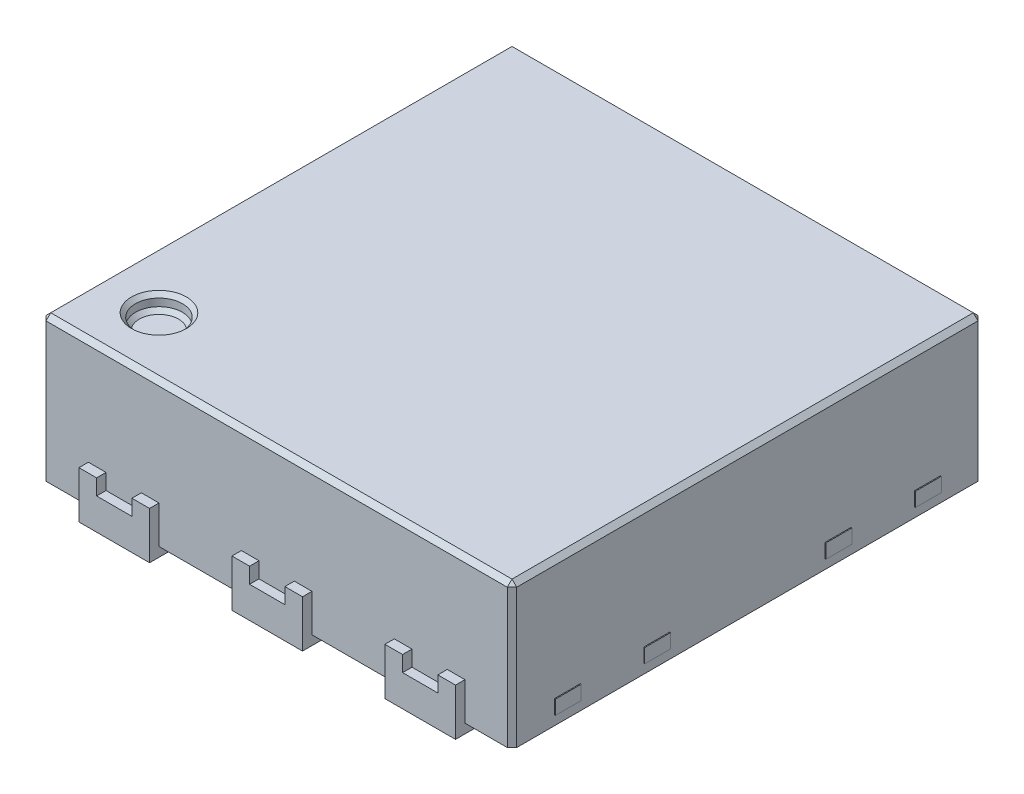
from build123d import *

# Parameters (mm, degrees)
BOSS_EXTRUDE1_DEPTH        = 0.2
SKETCH1_W                  = 0.67
SKETCH1_H                  = 1
BOSS_EXTRUDE1_2_DEPTH      = 0.2
SKETCH1_W_2                = 0.3
SKETCH1_H_2                = 0.29
BOSS_EXTRUDE1_3_DEPTH      = 0.2
BOSS_EXTRUDE1_4_DEPTH      = 0.2
BOSS_EXTRUDE1_5_DEPTH      = 0.2
BOSS_EXTRUDE1_6_DEPTH      = 0.2
BOSS_EXTRUDE1_7_DEPTH      = 0.2
BOSS_EXTRUDE1_8_DEPTH      = 0.2
SKETCH2_W                  = 0.15
SKETCH2_H                  = 0.133333334
CUT_EXTRUDE1_DEPTH         = 3.246558479
BOSS_EXTRUDE2_START        = 0.04
SKETCH3_W                  = 2
SKETCH3_H                  = 2
BOSS_EXTRUDE2_DEPTH        = 0.61
BOSS_EXTRUDE3_DEPTH        = 0.004
BOSS_EXTRUDE3_DEPTH_BACK   = 2.004
SKETCH4_W                  = 0.11
SKETCH4_H                  = 0.06
BOSS_EXTRUDE3_2_DEPTH      = 0.004
BOSS_EXTRUDE3_2_DEPTH_BACK = 2.004
BOSS_EXTRUDE3_3_DEPTH      = 0.004
BOSS_EXTRUDE3_3_DEPTH_BACK = 2.004
BOSS_EXTRUDE3_4_DEPTH      = 0.004
BOSS_EXTRUDE3_4_DEPTH_BACK = 2.004
SKETCH5_R                  = 0.1
CUT_EXTRUDE2_DEPTH         = 0.065
CHAMFER1_SIZE              = 0.016666667
CHAMFER2_SIZE              = 0.02


with BuildPart() as part:
    # Sketch1 → Boss-Extrude1 (new body)
    with BuildSketch(Plane(origin=(0, 0, 0), x_dir=(1, 0, 0), z_dir=(0, 1, 0))):
        Polygon((-0.825, 0.5), (-0.155, 0.5), (-0.155, -0.5), (-0.6575, -0.5), (-0.825, -0.3325), align=None)
    extrude(amount=BOSS_EXTRUDE1_DEPTH)


with BuildPart() as body_2:
    # Sketch1 → Boss-Extrude1 2 (new body)
    with BuildSketch(Plane(origin=(0, 0, 0), x_dir=(1, 0, 0), z_dir=(0, 1, 0))):
        with Locations((0.49, 0)):
            Rectangle(SKETCH1_W, SKETCH1_H)
    extrude(amount=BOSS_EXTRUDE1_2_DEPTH)


with BuildPart() as body_3:
    # Sketch1 → Boss-Extrude1 3 (new body)
    with BuildSketch(Plane(origin=(0, 0, 0), x_dir=(1, 0, 0), z_dir=(0, 1, 0))):
        with Locations((0, 0.895)):
            Rectangle(SKETCH1_W_2, SKETCH1_H_2)
    extrude(amount=BOSS_EXTRUDE1_3_DEPTH)


with BuildPart() as body_4:
    # Sketch1 → Boss-Extrude1 4 (new body)
    with BuildSketch(Plane(origin=(0, 0, 0), x_dir=(1, 0, 0), z_dir=(0, 1, 0))):
        with Locations((-0.65, 0.895)):
            Rectangle(SKETCH1_W_2, SKETCH1_H_2)
    extrude(amount=BOSS_EXTRUDE1_4_DEPTH)


with BuildPart() as body_5:
    # Sketch1 → Boss-Extrude1 5 (new body)
    with BuildSketch(Plane(origin=(0, 0, 0), x_dir=(1, 0, 0), z_dir=(0, 1, 0))):
        with Locations((0.65, 0.895)):
            Rectangle(SKETCH1_W_2, SKETCH1_H_2)
    extrude(amount=BOSS_EXTRUDE1_5_DEPTH)


with BuildPart() as body_6:
    # Sketch1 → Boss-Extrude1 6 (new body)
    with BuildSketch(Plane(origin=(0, 0, 0), x_dir=(1, 0, 0), z_dir=(0, 1, 0))):
        with Locations((0, -0.895)):
            Rectangle(SKETCH1_W_2, SKETCH1_H_2)
    extrude(amount=BOSS_EXTRUDE1_6_DEPTH)


with BuildPart() as body_7:
    # Sketch1 → Boss-Extrude1 7 (new body)
    with BuildSketch(Plane(origin=(0, 0, 0), x_dir=(1, 0, 0), z_dir=(0, 1, 0))):
        with Locations((0.65, -0.895)):
            Rectangle(SKETCH1_W_2, SKETCH1_H_2)
    extrude(amount=BOSS_EXTRUDE1_7_DEPTH)


with BuildPart() as body_8:
    # Sketch1 → Boss-Extrude1 8 (new body)
    with BuildSketch(Plane(origin=(0, 0, 0), x_dir=(1, 0, 0), z_dir=(0, 1, 0))):
        with Locations((-0.65, -0.895)):
            Rectangle(SKETCH1_W_2, SKETCH1_H_2)
    extrude(amount=BOSS_EXTRUDE1_8_DEPTH)


with BuildPart() as cut_extrude1_tool:
    # Sketch2 → Cut-Extrude1 (new, through all)
    with BuildSketch(Plane.XY.offset(1.04)):
        with Locations((-0.65, 0.2)):
            Rectangle(SKETCH2_W, SKETCH2_H)
        with Locations((0, 0.2)):
            Rectangle(SKETCH2_W, SKETCH2_H)
        with Locations((0.65, 0.2)):
            Rectangle(SKETCH2_W, SKETCH2_H)
    extrude(amount=-CUT_EXTRUDE1_DEPTH)


with BuildPart() as part_1:
    add(part.part)

    # Cut-Extrude1: cut by cut_extrude1_tool
    add(cut_extrude1_tool.part, mode=Mode.SUBTRACT)


with BuildPart() as body_2_1:
    add(body_2.part)

    # Cut-Extrude1: cut by cut_extrude1_tool
    add(cut_extrude1_tool.part, mode=Mode.SUBTRACT)


with BuildPart() as body_3_1:
    add(body_3.part)

    # Cut-Extrude1: cut by cut_extrude1_tool
    add(cut_extrude1_tool.part, mode=Mode.SUBTRACT)


with BuildPart() as body_4_1:
    add(body_4.part)

    # Cut-Extrude1: cut by cut_extrude1_tool
    add(cut_extrude1_tool.part, mode=Mode.SUBTRACT)


with BuildPart() as body_5_1:
    add(body_5.part)

    # Cut-Extrude1: cut by cut_extrude1_tool
    add(cut_extrude1_tool.part, mode=Mode.SUBTRACT)


with BuildPart() as body_6_1:
    add(body_6.part)

    # Cut-Extrude1: cut by cut_extrude1_tool
    add(cut_extrude1_tool.part, mode=Mode.SUBTRACT)


with BuildPart() as body_7_1:
    add(body_7.part)

    # Cut-Extrude1: cut by cut_extrude1_tool
    add(cut_extrude1_tool.part, mode=Mode.SUBTRACT)


with BuildPart() as body_8_1:
    add(body_8.part)

    # Cut-Extrude1: cut by cut_extrude1_tool
    add(cut_extrude1_tool.part, mode=Mode.SUBTRACT)


with BuildPart() as body_9:
    # Sketch3 → Boss-Extrude2 (new body)
    with BuildSketch(Plane(origin=(0, 0, 0), x_dir=(1, 0, 0), z_dir=(0, 1, 0)).offset(BOSS_EXTRUDE2_START)):
        Rectangle(SKETCH3_W, SKETCH3_H)
    extrude(amount=BOSS_EXTRUDE2_DEPTH)

    # Sketch5 → Cut-Extrude2 (cut)
    with BuildSketch(Plane(origin=(0, 0.65, 0), x_dir=(1, 0, 0), z_dir=(0, 1, 0))):
        with Locations(Location((-0.75, -0.75, 0), (0, 0, 270))):
            Circle(SKETCH5_R)
    extrude(amount=-CUT_EXTRUDE2_DEPTH, mode=Mode.SUBTRACT)

    # Chamfer1
    chamfer1_edges = [body_9.edges().sort_by_distance(p)[0] for p in [
        (-0.75, 0.585, 0.65),
        (-0.75, 0.65, 0.65),
    ]]
    chamfer(chamfer1_edges, length=CHAMFER1_SIZE)

    # Chamfer2
    chamfer2_edges = [body_9.edges().sort_by_distance(p)[0] for p in [
        (-1, 0.65, 0),
        (0, 0.65, 1),
        (1, 0.65, 0),
        (0, 0.65, -1),
        (1, 0.345, 1),
        (-1, 0.345, 1),
        (-1, 0.345, -1),
        (1, 0.345, -1),
    ]]
    chamfer(chamfer2_edges, length=CHAMFER2_SIZE)


with BuildPart() as body_10:
    # Sketch4 → Boss-Extrude3 (new, two sides: drawn at the far end of the back side and taken through both)
    with BuildSketch(Plane(origin=(1, 0, 0), x_dir=(0, 0, -1), z_dir=(1, 0, 0)).offset(-BOSS_EXTRUDE3_DEPTH_BACK)):
        with Locations((-0.765, 0.11)):
            Rectangle(SKETCH4_W, SKETCH4_H)
    extrude(amount=BOSS_EXTRUDE3_DEPTH + BOSS_EXTRUDE3_DEPTH_BACK)


with BuildPart() as body_11:
    # Sketch4 → Boss-Extrude3 2 (new, two sides: drawn at the far end of the back side and taken through both)
    with BuildSketch(Plane(origin=(1, 0, 0), x_dir=(0, 0, -1), z_dir=(1, 0, 0)).offset(-BOSS_EXTRUDE3_2_DEPTH_BACK)):
        with Locations((-0.385, 0.11)):
            Rectangle(SKETCH4_W, SKETCH4_H)
    extrude(amount=BOSS_EXTRUDE3_2_DEPTH + BOSS_EXTRUDE3_2_DEPTH_BACK)


with BuildPart() as body_12:
    # Sketch4 → Boss-Extrude3 3 (new, two sides: drawn at the far end of the back side and taken through both)
    with BuildSketch(Plane(origin=(1, 0, 0), x_dir=(0, 0, -1), z_dir=(1, 0, 0)).offset(-BOSS_EXTRUDE3_3_DEPTH_BACK)):
        with Locations((0.385, 0.11)):
            Rectangle(SKETCH4_W, SKETCH4_H)
    extrude(amount=BOSS_EXTRUDE3_3_DEPTH + BOSS_EXTRUDE3_3_DEPTH_BACK)


with BuildPart() as body_13:
    # Sketch4 → Boss-Extrude3 4 (new, two sides: drawn at the far end of the back side and taken through both)
    with BuildSketch(Plane(origin=(1, 0, 0), x_dir=(0, 0, -1), z_dir=(1, 0, 0)).offset(-BOSS_EXTRUDE3_4_DEPTH_BACK)):
        with Locations((0.765, 0.11)):
            Rectangle(SKETCH4_W, SKETCH4_H)
    extrude(amount=BOSS_EXTRUDE3_4_DEPTH + BOSS_EXTRUDE3_4_DEPTH_BACK)


solid = Compound([part_1.part, body_2_1.part, body_3_1.part, body_4_1.part, body_5_1.part, body_6_1.part, body_7_1.part, body_8_1.part, body_9.part, body_10.part, body_11.part, body_12.part, body_13.part])
